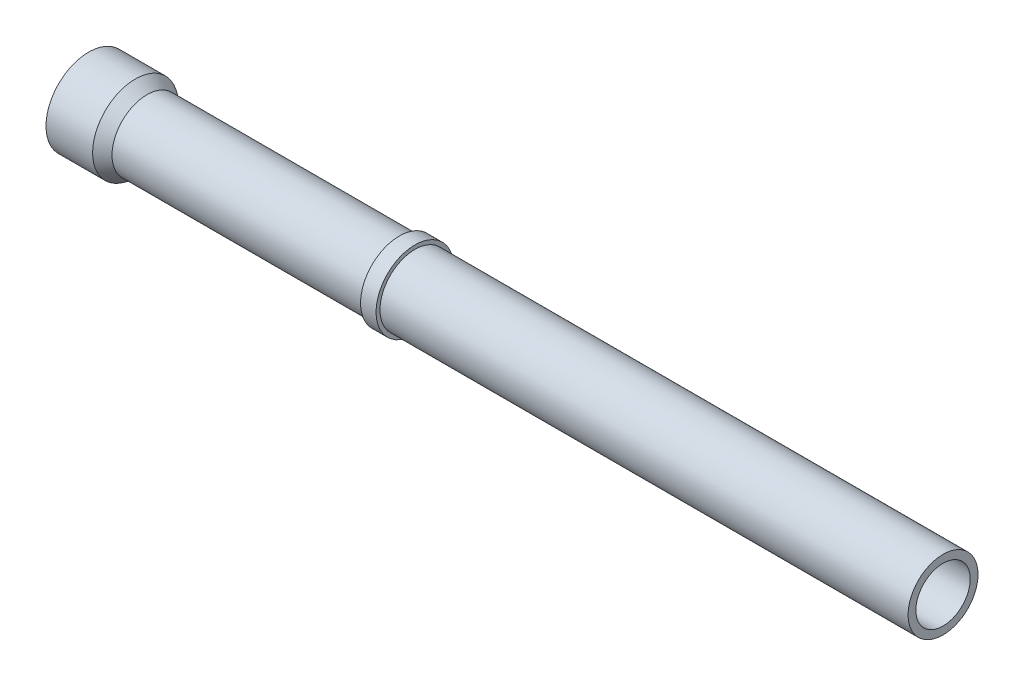
from build123d import *

# Parameters (mm, degrees)
SKETCH1_R           = 14.2875
SKETCH1_R_2         = 11.1125
BOSS_EXTRUDE1_DEPTH = 349.25
SKETCH2_R           = 15.875
SKETCH2_R_2         = 12.674707898
BOSS_EXTRUDE2_DEPTH = 6.35


with BuildPart() as part:
    # Sketch1 → Boss-Extrude1 (new body)
    with BuildSketch(Plane(origin=(0, 0, 0), x_dir=(0, 0, -1), z_dir=(1, 0, 0))):
        Circle(SKETCH1_R)
        Circle(SKETCH1_R_2, mode=Mode.SUBTRACT)
    extrude(amount=BOSS_EXTRUDE1_DEPTH)

    # Sketch2 → Boss-Extrude2 (add)
    with BuildSketch(Plane(origin=(127, 0, 0), x_dir=(0, 0, -1), z_dir=(1, 0, 0))):
        Circle(SKETCH2_R)
        Circle(SKETCH2_R_2, mode=Mode.SUBTRACT)
    extrude(amount=BOSS_EXTRUDE2_DEPTH)

    # Sketch3 → Revolve1 (revolve)
    with BuildSketch(Plane.XY, mode=Mode.PRIVATE) as revolve1_sk:
        Polygon((23.8125, 12.531653429), (0, 12.531653429), (0, 17.4625), (19.05, 17.4625), (23.8125, 14.2875), align=None)
    revolve(revolve1_sk.sketch.rotate(Axis((0, 0, 0), (1, 0, 0)), 90), axis=Axis((0, 0, 0), (1, 0, 0)))


solid = part.part
